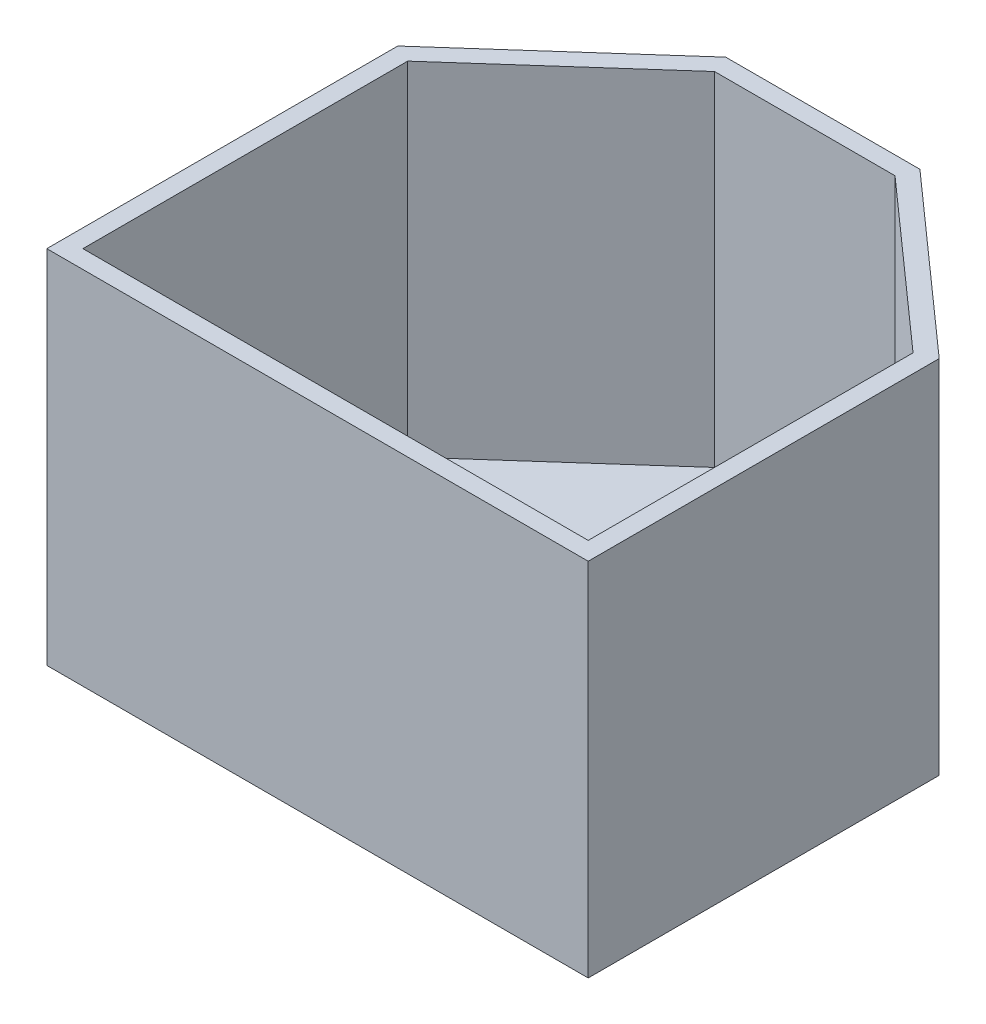
from build123d import *

# Parameters (mm, degrees)
BOSS_EXTRUDE1_DEPTH = 25.4
SHELL1_T            = -2.54


with BuildPart() as part:
    # Sketch2 → Boss-Extrude1 (new, symmetric)
    # profile 1 of 2: a face of its own
    with BuildSketch(Plane(origin=(0, 0, 0), x_dir=(1, 0, 0), z_dir=(0, 1, 0))):
        Polygon((13.665706279, 35.56), (38.1, 13.840627803), (38.1, -35.56), (-38.1, -35.56), (-38.1, 13.840627803), (-13.665706279, 35.56), align=None)
        Polygon((12.7, 33.02), (35.56, 12.7), (35.56, -33.02), (-35.56, -33.02), (-35.56, 12.7), (-12.7, 33.02), align=None, mode=Mode.SUBTRACT)
    # profile 2 of 2: a face of its own
    with BuildSketch(Plane(origin=(0, 0, 0), x_dir=(1, 0, 0), z_dir=(0, 1, 0))):
        Polygon((35.56, 12.7), (35.56, -33.02), (-35.56, -33.02), (-35.56, 12.7), (-12.7, 33.02), (12.7, 33.02), align=None)
    extrude(amount=BOSS_EXTRUDE1_DEPTH, both=True)

    # Shell1
    shell1_openings = [part.faces().sort_by_distance(p)[0] for p in [
        (0, 25.4, 3.07436115),
    ]]
    offset(amount=SHELL1_T, openings=shell1_openings, kind=Kind.INTERSECTION)


solid = part.part
